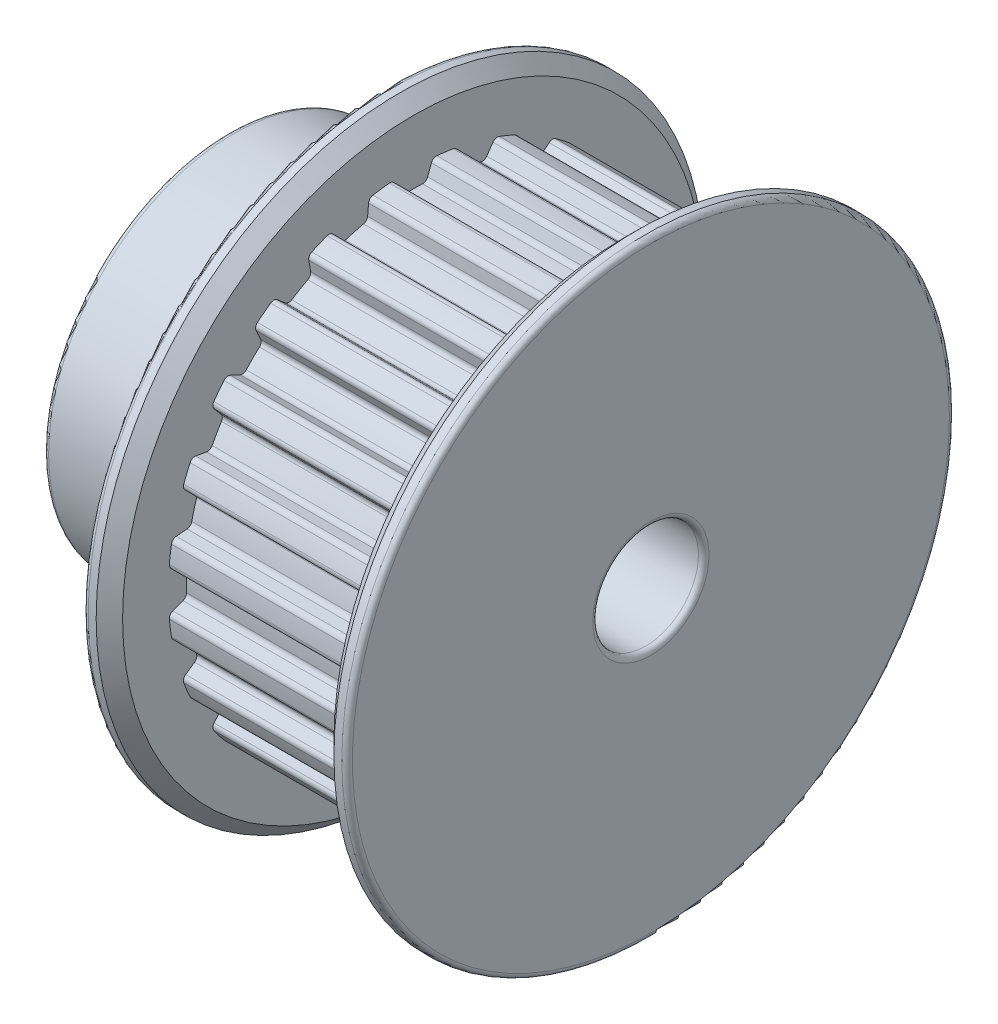
from build123d import *

# Parameters (mm, degrees)
SKETCH1_R           = 11.5
SKETCH1_R_2         = 2
BOSS_EXTRUDE1_DEPTH = 16
SKETCH2_OUTSIDE_W   = 32.25
SKETCH2_OUTSIDE_H   = 32.25
SKETCH2_OUTSIDE_R   = 7
CUT_EXTRUDE1_DEPTH  = 6
SKETCH3_W           = 8
SKETCH3_H           = 2.225
CUT_EXTRUDE2_DEPTH  = 8
CIRPATTERN1_COUNT   = 24
FILLET1_R           = 0.2
CHAMFER1_SIZE       = 0.5
FILLET2_R           = 0.2


with BuildPart() as part:
    # Sketch1 → Boss-Extrude1 (new body)
    with BuildSketch(Plane(origin=(0, 0, 0), x_dir=(0, 0, -1), z_dir=(1, 0, 0))):
        Circle(SKETCH1_R)
        Circle(SKETCH1_R_2, mode=Mode.SUBTRACT)
    extrude(amount=-BOSS_EXTRUDE1_DEPTH)

    # Sketch2 outside → Cut-Extrude1 (cut)
    with BuildSketch(Plane.ZY.offset(16)):
        Rectangle(SKETCH2_OUTSIDE_W, SKETCH2_OUTSIDE_H)
        Circle(SKETCH2_OUTSIDE_R, mode=Mode.SUBTRACT)
    extrude(amount=-CUT_EXTRUDE1_DEPTH, mode=Mode.SUBTRACT)

    # Sketch3 → Cut-Revolve1 (revolve, cut)
    with BuildSketch(Plane.XY, mode=Mode.PRIVATE) as cut_revolve1_sk:
        with Locations((-5, 10.3875)):
            Rectangle(SKETCH3_W, SKETCH3_H)
    revolve(cut_revolve1_sk.sketch.rotate(Axis((-16, 0, 0), (1, 0, 0)), 90), axis=Axis((-16, 0, 0), (1, 0, 0)), mode=Mode.SUBTRACT)

    # Sketch5 → Cut-Extrude2 (cut)
    with BuildSketch(Plane(origin=(-9, 0, 0), x_dir=(0, 0, -1), z_dir=(1, 0, 0))):
        with BuildLine():
            Line((-0.743903512, 9.245119392), (-0.5, 8.575))
            ThreePointArc((-0.5, 8.575), (0, 8.58956489), (0.5, 8.575))
            Line((0.5, 8.575), (0.743903512, 9.245119392))
            ThreePointArc((0.743903512, 9.245119392), (0, 9.275), (-0.743903512, 9.245119392))
        make_face()
    cut_extrude2 = extrude(amount=CUT_EXTRUDE2_DEPTH, mode=Mode.SUBTRACT)

    # CirPattern1: Cut-Extrude2 ×24 about axis
    cirpattern1_axis = Axis((0, 0, 0), (1, 0, 0))
    for i in range(1, CIRPATTERN1_COUNT):
        add(cut_extrude2.rotate(cirpattern1_axis, i * 360 / CIRPATTERN1_COUNT), mode=Mode.SUBTRACT)

    # Fillet1
    fillet1_edges = [part.edges().sort_by_distance(p)[0] for p in [
        (-5, -0.743903512, -9.245119392),
        (-5, -2.702336225, -8.153404438),
        (-5, -1.736410399, -8.412223483),
        (-5, -1.674257358, -9.122635984),
        (-5, -3.111368587, -8.737563191),
        (-5, -4.720512702, -7.176167837),
        (-5, -3.854487298, -7.676167837),
        (-5, -3.978320356, -8.37846001),
        (-5, -5.266799035, -7.634556498),
        (-5, -6.416994039, -5.709887258),
        (-5, -5.709887258, -6.416994039),
        (-5, -6.011267397, -7.063305833),
        (-5, -7.063305833, -6.011267397),
        (-5, -7.676167837, -3.854487298),
        (-5, -7.176167837, -4.720512702),
        (-5, -7.634556498, -5.266799035),
        (-5, -8.37846001, -3.978320356),
        (-5, -8.412223483, -1.736410399),
        (-5, -8.153404438, -2.702336225),
        (-5, -8.737563191, -3.111368587),
        (-5, -9.122635984, -1.674257358),
        (-5, -8.575, 0.5),
        (-5, -8.575, -0.5),
        (-5, -9.245119392, -0.743903512),
        (-5, -9.245119392, 0.743903512),
        (-5, -8.153404438, 2.702336225),
        (-5, -8.412223483, 1.736410399),
        (-5, -9.122635984, 1.674257358),
        (-5, -8.737563191, 3.111368587),
        (-5, -7.176167837, 4.720512702),
        (-5, -7.676167837, 3.854487298),
        (-5, -8.37846001, 3.978320356),
        (-5, -7.634556498, 5.266799035),
        (-5, -5.709887258, 6.416994039),
        (-5, -6.416994039, 5.709887258),
        (-5, -7.063305833, 6.011267397),
        (-5, -6.011267397, 7.063305833),
        (-5, -3.854487298, 7.676167837),
        (-5, -4.720512702, 7.176167837),
        (-5, -5.266799035, 7.634556498),
        (-5, -3.978320356, 8.37846001),
        (-5, -1.736410399, 8.412223483),
        (-5, -2.702336225, 8.153404438),
        (-5, -3.111368587, 8.737563191),
        (-5, -1.674257358, 9.122635984),
        (-5, 0.5, 8.575),
        (-5, -0.5, 8.575),
        (-5, -0.743903512, 9.245119392),
        (-5, 0.743903512, 9.245119392),
        (-5, 2.702336225, 8.153404438),
        (-5, 1.736410399, 8.412223483),
        (-5, 1.674257358, 9.122635984),
        (-5, 3.111368587, 8.737563191),
        (-5, 4.720512702, 7.176167837),
        (-5, 3.854487298, 7.676167837),
        (-5, 3.978320356, 8.37846001),
        (-5, 5.266799035, 7.634556498),
        (-5, 6.416994039, 5.709887258),
        (-5, 5.709887258, 6.416994039),
        (-5, 6.011267397, 7.063305833),
        (-5, 7.063305833, 6.011267397),
        (-5, 7.676167837, 3.854487298),
        (-5, 7.176167837, 4.720512702),
        (-5, 7.634556498, 5.266799035),
        (-5, 8.37846001, 3.978320356),
        (-5, 8.412223483, 1.736410399),
        (-5, 8.153404438, 2.702336225),
        (-5, 8.737563191, 3.111368587),
        (-5, 9.122635984, 1.674257358),
        (-5, 8.575, -0.5),
        (-5, 8.575, 0.5),
        (-5, 9.245119392, 0.743903512),
        (-5, 9.245119392, -0.743903512),
        (-5, 8.153404438, -2.702336225),
        (-5, 8.412223483, -1.736410399),
        (-5, 9.122635984, -1.674257358),
        (-5, 8.737563191, -3.111368587),
        (-5, 7.176167837, -4.720512702),
        (-5, 7.676167837, -3.854487298),
        (-5, 8.37846001, -3.978320356),
        (-5, 7.634556498, -5.266799035),
        (-5, 5.709887258, -6.416994039),
        (-5, 6.416994039, -5.709887258),
        (-5, 7.063305833, -6.011267397),
        (-5, 6.011267397, -7.063305833),
        (-5, 3.854487298, -7.676167837),
        (-5, 4.720512702, -7.176167837),
        (-5, 5.266799035, -7.634556498),
        (-5, 3.978320356, -8.37846001),
        (-5, 1.736410399, -8.412223483),
        (-5, 2.702336225, -8.153404438),
        (-5, 3.111368587, -8.737563191),
        (-5, 1.674257358, -9.122635984),
        (-5, -0.5, -8.575),
        (-5, 0.5, -8.575),
        (-5, 0.743903512, -9.245119392),
    ]]
    fillet(fillet1_edges, radius=FILLET1_R)

    # Chamfer1
    chamfer1_edges = [part.edges().sort_by_distance(p)[0] for p in [
        (-9, 0, 11.5),
        (-1, 0, 11.5),
    ]]
    chamfer(chamfer1_edges, length=CHAMFER1_SIZE)

    # Fillet2
    fillet2_edges = [part.edges().sort_by_distance(p)[0] for p in [
        (-10, 0, 11.5),
        (-10, 0, -7),
        (-16, 0, -7),
        (0, 0, 11.5),
        (0, 0, 2),
    ]]
    fillet(fillet2_edges, radius=FILLET2_R)


solid = part.part
